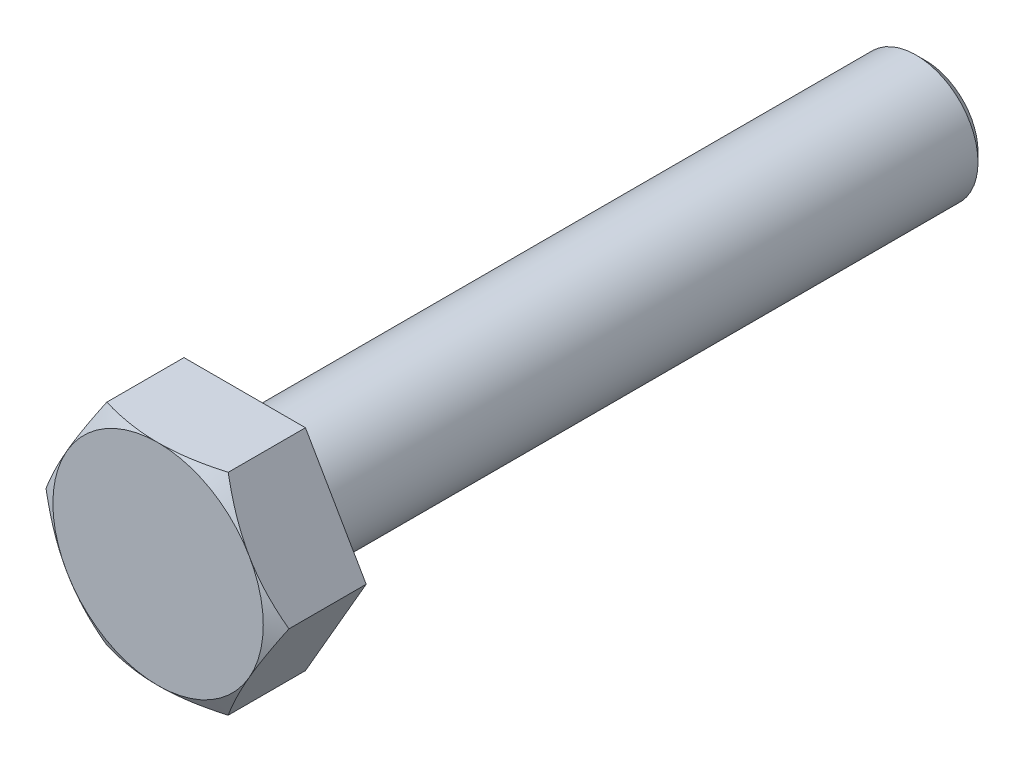
from build123d import *

# Parameters (mm, degrees)
BOSS_EXTRUDE1_DEPTH = 7
SKETCH3_R           = 5
BOSS_EXTRUDE2_DEPTH = 55
CHAMFER1_SIZE       = 0.75


with BuildPart() as part:
    # Sketch1 → Boss-Extrude1 (new body)
    with BuildSketch(Plane.XY):
        Polygon((9.814954576, 0), (4.907477288, 8.5), (-4.907477288, 8.5), (-9.814954576, 0), (-4.907477288, -8.5), (4.907477288, -8.5), align=None)
    extrude(amount=BOSS_EXTRUDE1_DEPTH)

    # Sketch2 → Cut-Revolve1 (revolve, cut)
    with BuildSketch(Plane(origin=(0, 0, 0), x_dir=(0, 0, -1), z_dir=(1, 0, 0))):
        Polygon((-7, 8.5), (-7, 13.5), (-4.113248654, 13.5), align=None)
    revolve(axis=Axis((0, 0, 7), (0, 0, -1)), mode=Mode.SUBTRACT)

    # Sketch3 → Boss-Extrude2 (add)
    with BuildSketch(Plane(origin=(0, 0, 0), x_dir=(-1, 0, 0), z_dir=(0, 0, -1))):
        with Locations(Location((0, 0, 0), (0, 0, 180))):
            Circle(SKETCH3_R)
    extrude(amount=BOSS_EXTRUDE2_DEPTH)

    # Chamfer1
    chamfer1_edges = [part.edges().sort_by_distance(p)[0] for p in [
        (-5, 0, -55),
    ]]
    chamfer(chamfer1_edges, length=CHAMFER1_SIZE)


solid = part.part
